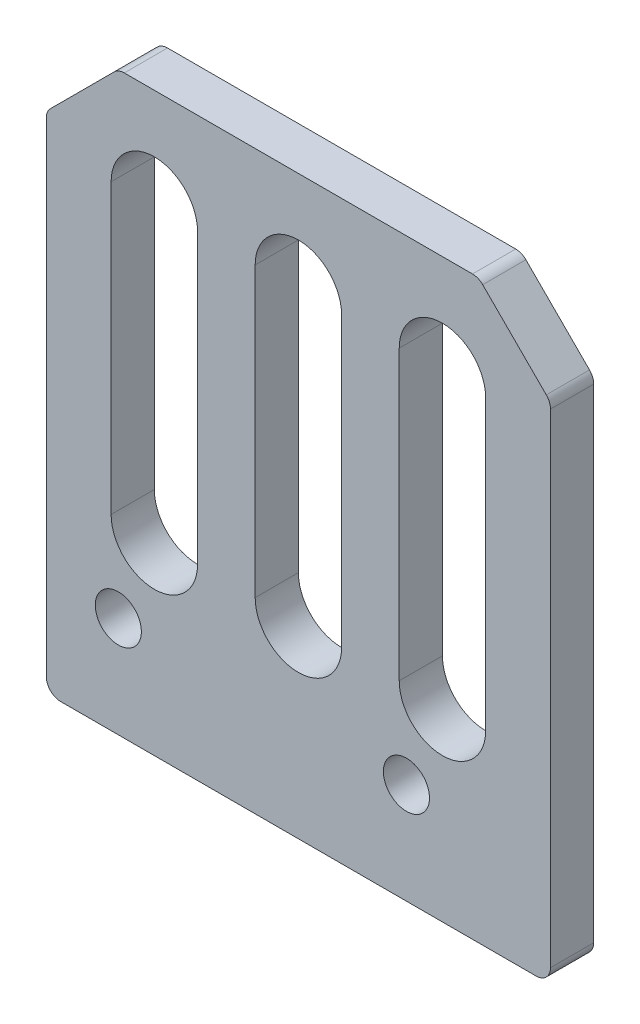
from build123d import *

# Parameters (mm, degrees)
SKETCH_1_W          = 35
SKETCH_1_H          = 40
EXTRUDE_1_DEPTH     = 3
CHAMFER_1_SIZE      = 5
FILLET_1_R          = 1
SKETCH_2_R          = 1.6
CUT_EXTRUDE_1_DEPTH = 27.744158241
CUT_EXTRUDE_2_DEPTH = 27.744158241


with BuildPart() as part:
    # 草图1 → 凸台-拉伸1 (new body)
    with BuildSketch(Plane.XY):
        Rectangle(SKETCH_1_W, SKETCH_1_H)
    extrude(amount=EXTRUDE_1_DEPTH)

    # 倒角1
    chamfer_1_edges = [part.edges().sort_by_distance(p)[0] for p in [
        (-17.5, 20, 1.5),
        (17.5, 20, 1.5),
    ]]
    chamfer(chamfer_1_edges, length=CHAMFER_1_SIZE)

    # 圆角1
    fillet_1_edges = [part.edges().sort_by_distance(p)[0] for p in [
        (-17.5, 15, 1.5),
        (12.5, 20, 1.5),
        (-12.5, 20, 1.5),
        (17.5, 15, 1.5),
        (17.5, -20, 1.5),
        (-17.5, -20, 1.5),
    ]]
    fillet(fillet_1_edges, radius=FILLET_1_R)

    # 草图2 → 切除-拉伸1 (cut, through all)
    with BuildSketch(Plane.XY.offset(3)):
        with Locations((-12.5, -13)):
            Circle(SKETCH_2_R)
        with Locations((7.5, -13)):
            Circle(SKETCH_2_R)
    extrude(amount=-CUT_EXTRUDE_1_DEPTH, mode=Mode.SUBTRACT)

    # 草图3 → 切除-拉伸2 (cut, through all)
    with BuildSketch(Plane.XY.offset(3)):
        with BuildLine():
            Line((3, 13), (3, -7))
            ThreePointArc((3, -7), (0, -10), (-3, -7))
            Line((-3, -7), (-3, 13))
            ThreePointArc((-3, 13), (0, 16), (3, 13))
        make_face()
        with BuildLine():
            Line((-7, 13), (-7, -7))
            ThreePointArc((-7, -7), (-10, -10), (-13, -7))
            Line((-13, -7), (-13, 13))
            ThreePointArc((-13, 13), (-10, 16), (-7, 13))
        make_face()
        with BuildLine():
            Line((13, 13), (13, -7))
            ThreePointArc((13, -7), (10, -10), (7, -7))
            Line((7, -7), (7, 13))
            ThreePointArc((7, 13), (10, 16), (13, 13))
        make_face()
    extrude(amount=-CUT_EXTRUDE_2_DEPTH, mode=Mode.SUBTRACT)


solid = part.part
